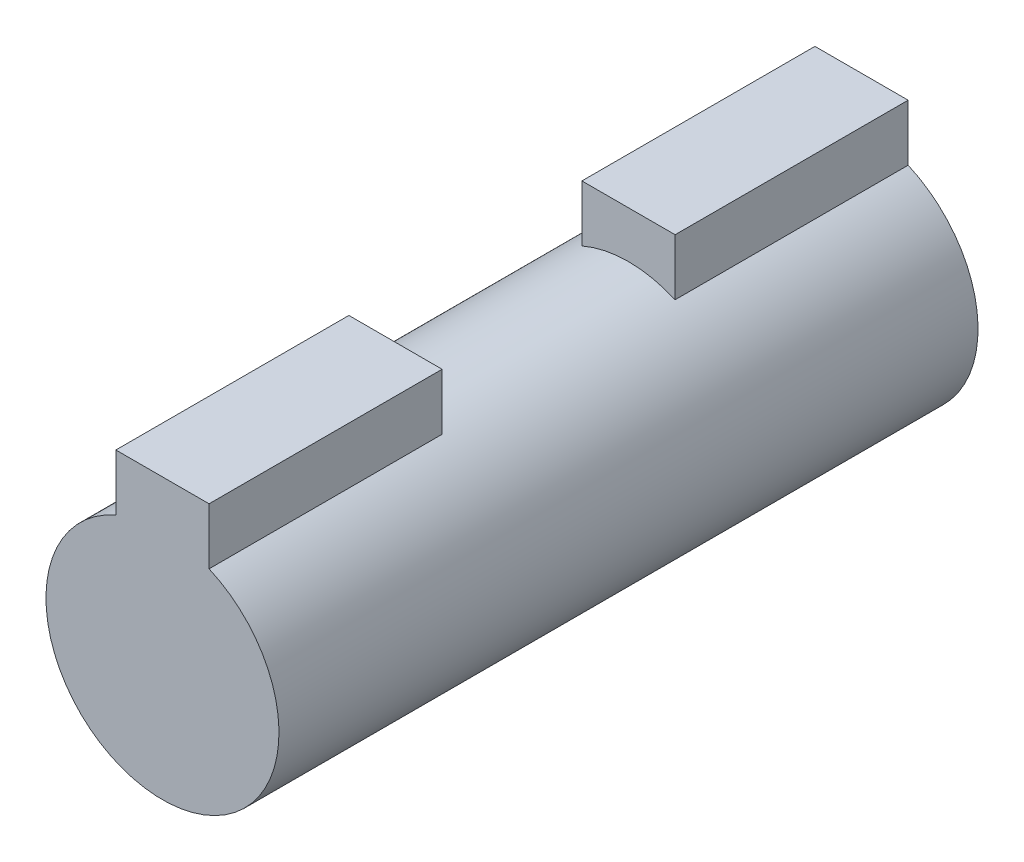
from build123d import *

# Parameters (mm, degrees)
BOSS_EXTRUDE1_DEPTH = 30
CUT_EXTRUDE1_START  = -20
SKETCH2_R           = 10
SKETCH2_R_2         = 5
CUT_EXTRUDE1_DEPTH  = 10


with BuildPart() as part:
    # Sketch1 → Boss-Extrude1 (new body)
    with BuildSketch(Plane.XY):
        with BuildLine():
            Line((2, 4.582575695), (2, 7))
            Line((2, 7), (-2, 7))
            Line((-2, 7), (-2, 4.582575695))
            ThreePointArc((-2, 4.582575695), (0, -5), (2, 4.582575695))
        make_face()
    extrude(amount=BOSS_EXTRUDE1_DEPTH)

    # Sketch2 → Cut-Extrude1 (cut)
    with BuildSketch(Plane.XY.offset(30).offset(CUT_EXTRUDE1_START)):
        Circle(SKETCH2_R)
        Circle(SKETCH2_R_2, mode=Mode.SUBTRACT)
    extrude(amount=CUT_EXTRUDE1_DEPTH, mode=Mode.SUBTRACT)


solid = part.part
